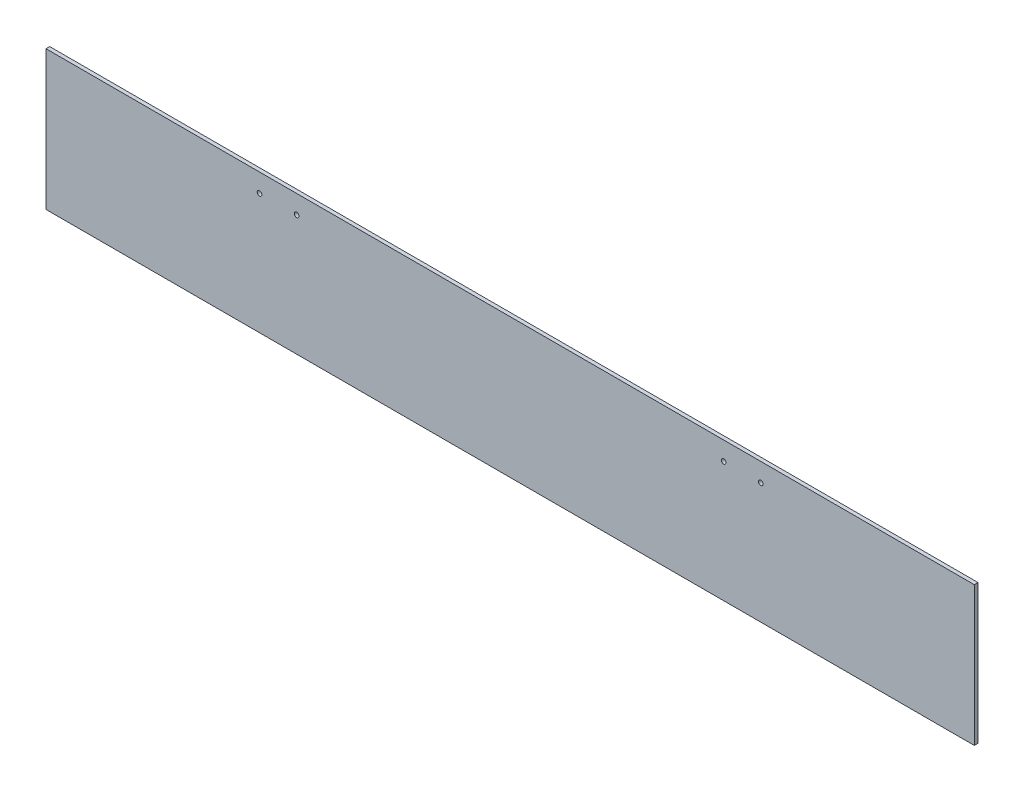
from build123d import *

# Parameters (mm, degrees)
SKETCH2_W               = 1000
SKETCH2_H               = 150
BOSS_EXTRUDE1_DEPTH     = 2
TAP_DRILL_FOR_M6_TAP1_D = 5


with BuildPart() as part:
    # Sketch2 → Boss-Extrude1 (new, symmetric)
    with BuildSketch(Plane.XY):
        with Locations((0, 75)):
            Rectangle(SKETCH2_W, SKETCH2_H)
    extrude(amount=BOSS_EXTRUDE1_DEPTH, both=True)

    # Tap Drill for M6 Tap1 (through all)
    with Locations(Plane.XY.offset(2)):
        with Locations((270, 130), (-270, 130), (-230, 130), (230, 130)):
            Hole(TAP_DRILL_FOR_M6_TAP1_D / 2)


solid = part.part
